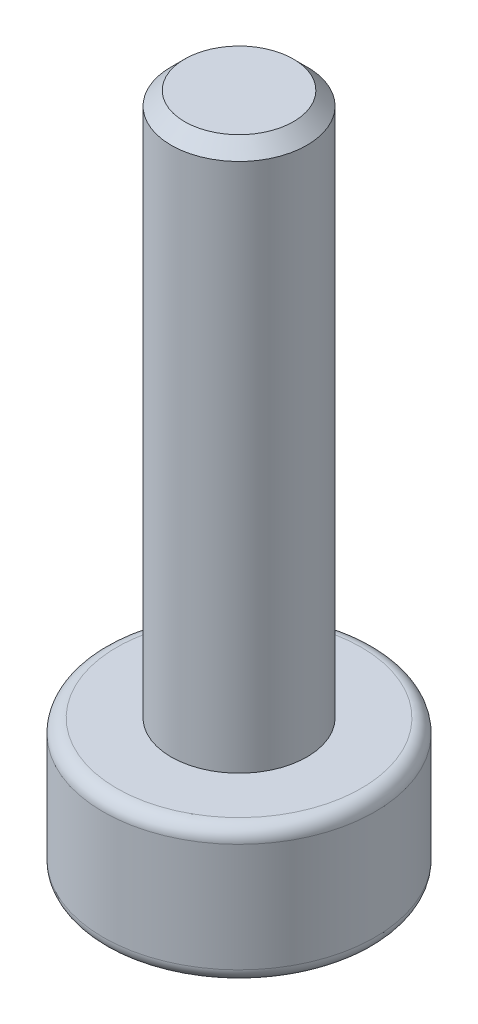
from build123d import *

# Parameters (mm, degrees)
SKETCH_2_R          = 2
EXTRUDE_1_DEPTH     = 2
SKETCH_3_R          = 1
EXTRUDE_2_DEPTH     = 8
FILLET_1_R          = 0.2
SKETCH_4_R          = 0.765
CUT_EXTRUDE_1_DEPTH = 1.52
CHAMFER_1_SIZE      = 0.1
CHAMFER_2_SIZE      = 0.2


with BuildPart() as part:
    # 草图2 → 凸台-拉伸1 (new body)
    with BuildSketch(Plane(origin=(0, 0, 0), x_dir=(1, 0, 0), z_dir=(0, 1, 0))):
        with Locations(Location((0, 0, 0), (0, 0, 270))):
            Circle(SKETCH_2_R)
    extrude(amount=EXTRUDE_1_DEPTH)

    # 草图3 → 凸台-拉伸2 (add)
    with BuildSketch(Plane(origin=(0, 2, 0), x_dir=(1, 0, 0), z_dir=(0, 1, 0))):
        with Locations(Location((0, 0, 0), (0, 0, 270))):
            Circle(SKETCH_3_R)
    extrude(amount=EXTRUDE_2_DEPTH)

    # 圆角1
    fillet_1_edges = [part.edges().sort_by_distance(p)[0] for p in [
        (0, 0, -2),
        (0, 2, -2),
    ]]
    fillet(fillet_1_edges, radius=FILLET_1_R)

    # 草图4 → 切除-拉伸1 (cut)
    with BuildSketch(Plane.XZ):
        with Locations(Location((0, 0, 0), (0, 0, 270))):
            Circle(SKETCH_4_R)
    extrude(amount=-CUT_EXTRUDE_1_DEPTH, mode=Mode.SUBTRACT)

    # 倒角1
    chamfer_1_edges = [part.edges().sort_by_distance(p)[0] for p in [
        (0, 0, 0.765),
    ]]
    chamfer(chamfer_1_edges, length=CHAMFER_1_SIZE)

    # 倒角2
    chamfer_2_edges = [part.edges().sort_by_distance(p)[0] for p in [
        (0, 10, -1),
    ]]
    chamfer(chamfer_2_edges, length=CHAMFER_2_SIZE)


solid = part.part
